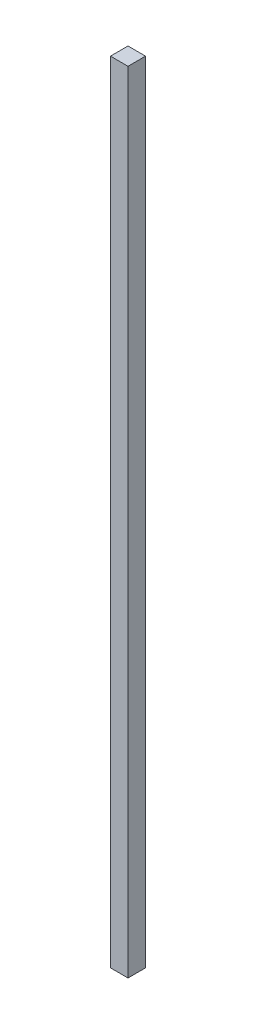
from build123d import *

# Parameters (mm, degrees)
SKETCH1_W           = 20
SKETCH1_H           = 20
BOSS_EXTRUDE1_DEPTH = 900


with BuildPart() as part:
    # Sketch1 → Boss-Extrude1 (new body)
    with BuildSketch(Plane(origin=(0, 0, 0), x_dir=(1, 0, 0), z_dir=(0, 1, 0))):
        Rectangle(SKETCH1_W, SKETCH1_H)
    extrude(amount=BOSS_EXTRUDE1_DEPTH)


solid = part.part
